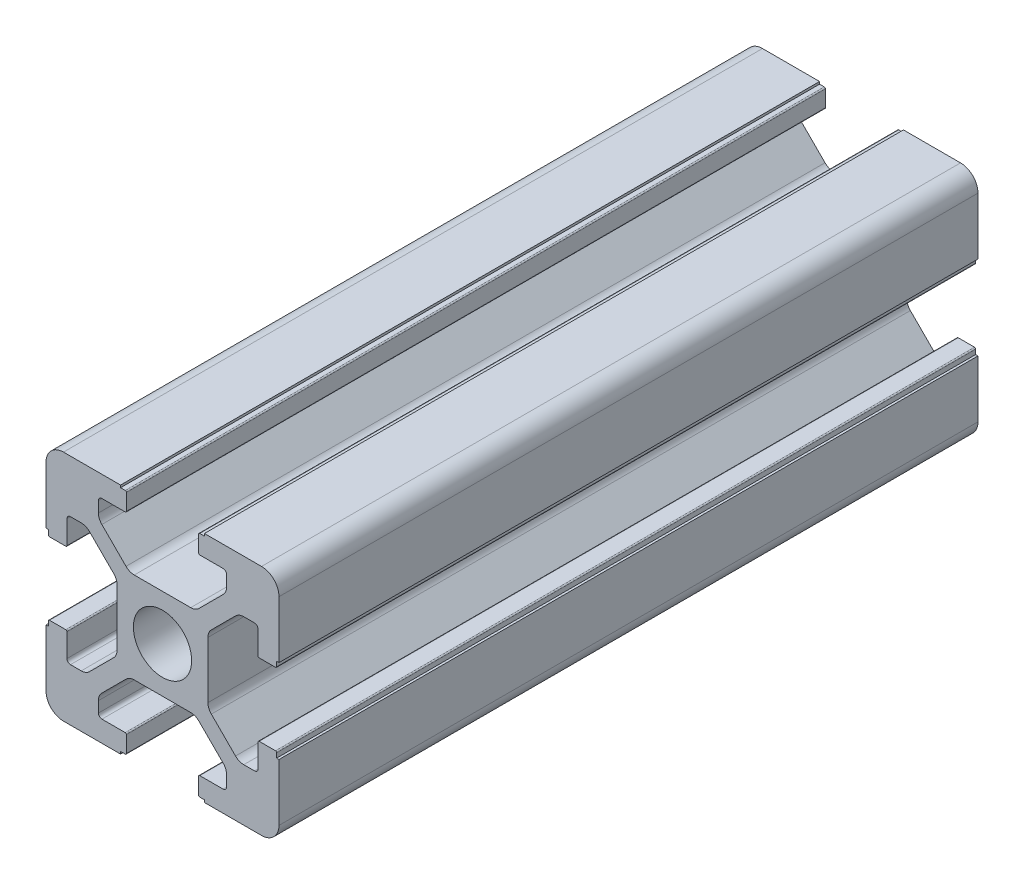
from build123d import *

# Parameters (mm, degrees)
SKETCH_1_R      = 2.5
EXTRUDE_1_DEPTH = 60
FILLET_1_R      = 1.5


with BuildPart() as part:
    # 草图1 → 凸台-拉伸1 (new body)
    with BuildSketch(Plane.XY):
        with BuildLine():
            Line((20, 13.6), (20, 20))
            Line((20, 20), (13.6, 20))
            Line((13.6, 20), (13.6, 19.8))
            Line((13.6, 19.8), (13.2, 19.8))
            ThreePointArc((13.2, 19.8), (13.129289322, 19.770710678), (13.1, 19.7))
            Line((13.1, 19.7), (13.1, 18.3))
            ThreePointArc((13.1, 18.3), (13.129289322, 18.229289322), (13.2, 18.2))
            Line((13.2, 18.2), (15.2, 18.2))
            ThreePointArc((15.2, 18.2), (15.412132034, 18.112132034), (15.5, 17.9))
            Line((15.5, 17.9), (15.5, 16.974873734))
            ThreePointArc((15.5, 16.974873734), (15.423879533, 16.592190302), (15.207106781, 16.267766953))
            Line((15.207106781, 16.267766953), (13.132233047, 14.192893219))
            ThreePointArc((13.132233047, 14.192893219), (12.807809698, 13.976120467), (12.425126266, 13.9))
            Line((12.425126266, 13.9), (7.574873734, 13.9))
            ThreePointArc((7.574873734, 13.9), (7.192190302, 13.976120467), (6.867766953, 14.192893219))
            Line((6.867766953, 14.192893219), (4.792893219, 16.267766953))
            ThreePointArc((4.792893219, 16.267766953), (4.576120467, 16.592190302), (4.5, 16.974873734))
            Line((4.5, 16.974873734), (4.5, 17.9))
            ThreePointArc((4.5, 17.9), (4.587867966, 18.112132034), (4.8, 18.2))
            Line((4.8, 18.2), (6.8, 18.2))
            ThreePointArc((6.8, 18.2), (6.870710678, 18.229289322), (6.9, 18.3))
            Line((6.9, 18.3), (6.9, 19.7))
            ThreePointArc((6.9, 19.7), (6.870710678, 19.770710678), (6.8, 19.8))
            Line((6.8, 19.8), (6.4, 19.8))
            Line((6.4, 19.8), (6.4, 20))
            Line((6.4, 20), (0, 20))
            Line((0, 20), (0, 13.6))
            Line((0, 13.6), (0.2, 13.6))
            Line((0.2, 13.6), (0.2, 13.2))
            ThreePointArc((0.2, 13.2), (0.229289322, 13.129289322), (0.3, 13.1))
            Line((0.3, 13.1), (1.7, 13.1))
            ThreePointArc((1.7, 13.1), (1.770710678, 13.129289322), (1.8, 13.2))
            Line((1.8, 13.2), (1.8, 15.2))
            ThreePointArc((1.8, 15.2), (1.887867966, 15.412132034), (2.1, 15.5))
            Line((2.1, 15.5), (3.025126266, 15.5))
            ThreePointArc((3.025126266, 15.5), (3.407809698, 15.423879533), (3.732233047, 15.207106781))
            Line((3.732233047, 15.207106781), (5.807106781, 13.132233047))
            ThreePointArc((5.807106781, 13.132233047), (6.023879533, 12.807809698), (6.1, 12.425126266))
            Line((6.1, 12.425126266), (6.1, 7.574873734))
            ThreePointArc((6.1, 7.574873734), (6.023879533, 7.192190302), (5.807106781, 6.867766953))
            Line((5.807106781, 6.867766953), (3.732233047, 4.792893219))
            ThreePointArc((3.732233047, 4.792893219), (3.407809698, 4.576120467), (3.025126266, 4.5))
            Line((3.025126266, 4.5), (2.1, 4.5))
            ThreePointArc((2.1, 4.5), (1.887867966, 4.587867966), (1.8, 4.8))
            Line((1.8, 4.8), (1.8, 6.8))
            ThreePointArc((1.8, 6.8), (1.770710678, 6.870710678), (1.7, 6.9))
            Line((1.7, 6.9), (0.3, 6.9))
            ThreePointArc((0.3, 6.9), (0.229289322, 6.870710678), (0.2, 6.8))
            Line((0.2, 6.8), (0.2, 6.4))
            Line((0.2, 6.4), (0, 6.4))
            Line((0, 6.4), (0, 0))
            Line((0, 0), (6.4, 0))
            Line((6.4, 0), (6.4, 0.2))
            Line((6.4, 0.2), (6.8, 0.2))
            ThreePointArc((6.8, 0.2), (6.870710678, 0.229289322), (6.9, 0.3))
            Line((6.9, 0.3), (6.9, 1.7))
            ThreePointArc((6.9, 1.7), (6.870710678, 1.770710678), (6.8, 1.8))
            Line((6.8, 1.8), (4.8, 1.8))
            ThreePointArc((4.8, 1.8), (4.587867966, 1.887867966), (4.5, 2.1))
            Line((4.5, 2.1), (4.5, 3.025126266))
            ThreePointArc((4.5, 3.025126266), (4.576120467, 3.407809698), (4.792893219, 3.732233047))
            Line((4.792893219, 3.732233047), (6.867766953, 5.807106781))
            ThreePointArc((6.867766953, 5.807106781), (7.192190302, 6.023879533), (7.574873734, 6.1))
            Line((7.574873734, 6.1), (12.425126266, 6.1))
            ThreePointArc((12.425126266, 6.1), (12.807809698, 6.023879533), (13.132233047, 5.807106781))
            Line((13.132233047, 5.807106781), (15.207106781, 3.732233047))
            ThreePointArc((15.207106781, 3.732233047), (15.423879533, 3.407809698), (15.5, 3.025126266))
            Line((15.5, 3.025126266), (15.5, 2.1))
            ThreePointArc((15.5, 2.1), (15.412132034, 1.887867966), (15.2, 1.8))
            Line((15.2, 1.8), (13.2, 1.8))
            ThreePointArc((13.2, 1.8), (13.129289322, 1.770710678), (13.1, 1.7))
            Line((13.1, 1.7), (13.1, 0.3))
            ThreePointArc((13.1, 0.3), (13.129289322, 0.229289322), (13.2, 0.2))
            Line((13.2, 0.2), (13.6, 0.2))
            Line((13.6, 0.2), (13.6, 0))
            Line((13.6, 0), (20, 0))
            Line((20, 0), (20, 6.4))
            Line((20, 6.4), (19.8, 6.4))
            Line((19.8, 6.4), (19.8, 6.8))
            ThreePointArc((19.8, 6.8), (19.770710678, 6.870710678), (19.7, 6.9))
            Line((19.7, 6.9), (18.3, 6.9))
            ThreePointArc((18.3, 6.9), (18.229289322, 6.870710678), (18.2, 6.8))
            Line((18.2, 6.8), (18.2, 4.8))
            ThreePointArc((18.2, 4.8), (18.112132034, 4.587867966), (17.9, 4.5))
            Line((17.9, 4.5), (16.974873734, 4.5))
            ThreePointArc((16.974873734, 4.5), (16.592190302, 4.576120467), (16.267766953, 4.792893219))
            Line((16.267766953, 4.792893219), (14.192893219, 6.867766953))
            ThreePointArc((14.192893219, 6.867766953), (13.976120467, 7.192190302), (13.9, 7.574873734))
            Line((13.9, 7.574873734), (13.9, 12.425126266))
            ThreePointArc((13.9, 12.425126266), (13.976120467, 12.807809698), (14.192893219, 13.132233047))
            Line((14.192893219, 13.132233047), (16.267766953, 15.207106781))
            ThreePointArc((16.267766953, 15.207106781), (16.592190302, 15.423879533), (16.974873734, 15.5))
            Line((16.974873734, 15.5), (17.9, 15.5))
            ThreePointArc((17.9, 15.5), (18.112132034, 15.412132034), (18.2, 15.2))
            Line((18.2, 15.2), (18.2, 13.2))
            ThreePointArc((18.2, 13.2), (18.229289322, 13.129289322), (18.3, 13.1))
            Line((18.3, 13.1), (19.7, 13.1))
            ThreePointArc((19.7, 13.1), (19.770710678, 13.129289322), (19.8, 13.2))
            Line((19.8, 13.2), (19.8, 13.6))
            Line((19.8, 13.6), (20, 13.6))
        make_face()
        with Locations((10, 10)):
            Circle(SKETCH_1_R, mode=Mode.SUBTRACT)
    extrude(amount=EXTRUDE_1_DEPTH)

    # 圆角1
    fillet_1_edges = [part.edges().sort_by_distance(p)[0] for p in [
        (0, 0, 30),
        (0, 20, 30),
        (20, 20, 30),
        (20, 0, 30),
    ]]
    fillet(fillet_1_edges, radius=FILLET_1_R)


solid = part.part
